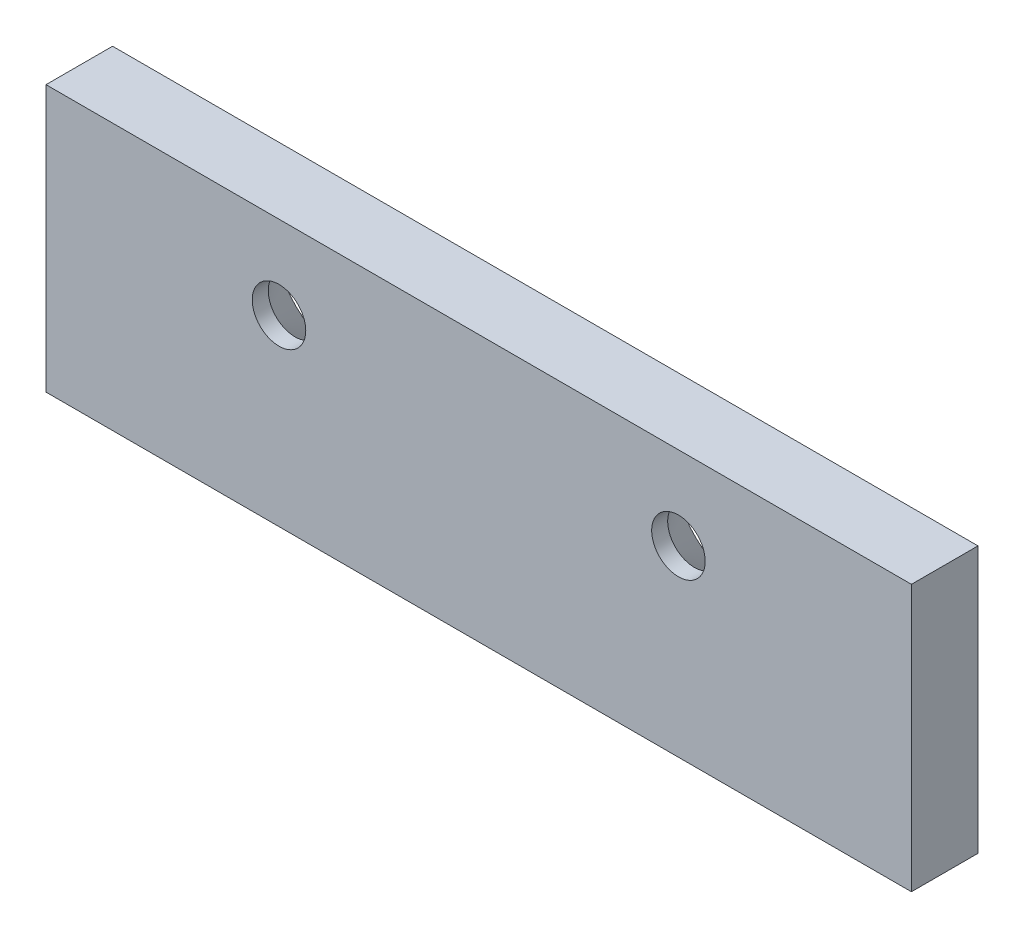
from build123d import *

# Parameters (mm, degrees)
SKETCH1_W                        = 82.55
SKETCH1_H                        = 25.4
BOSS_EXTRUDE1_DEPTH              = 6.35
F_1_4_20_TAPPED_HOLE1_AT_2_COUNT = 2
F_1_4_20_TAPPED_HOLE1_AT_2_PITCH = 38.1


with BuildPart() as part:
    # Sketch1 → Boss-Extrude1 (new body)
    with BuildSketch(Plane.XY):
        with Locations((41.275, 12.7)):
            Rectangle(SKETCH1_W, SKETCH1_H)
    extrude(amount=-BOSS_EXTRUDE1_DEPTH)

    # Sketch3 → 1/4-20 Tapped Hole1 (revolve, cut)
    with BuildSketch(Plane(origin=(22.225, 17.4625, 0), x_dir=(0, -1, 0), z_dir=(1, 0, 0))):
        Polygon((0, 0), (0, 6.35), (6.7437, 6.35), (2.5527, 1.528806005), (2.5527, 0), align=None)
    f_1_4_20_tapped_hole1 = revolve(axis=Axis((22.225, 17.4625, 6.35), (0, 0, -1)), mode=Mode.SUBTRACT)

    # 1/4-20 Tapped Hole1 at 2: 1/4-20 Tapped Hole1 ×2
    with Locations(*[(i * F_1_4_20_TAPPED_HOLE1_AT_2_PITCH, 0, 0) for i in range(1, F_1_4_20_TAPPED_HOLE1_AT_2_COUNT)]):
        add(f_1_4_20_tapped_hole1, mode=Mode.SUBTRACT)


solid = part.part
